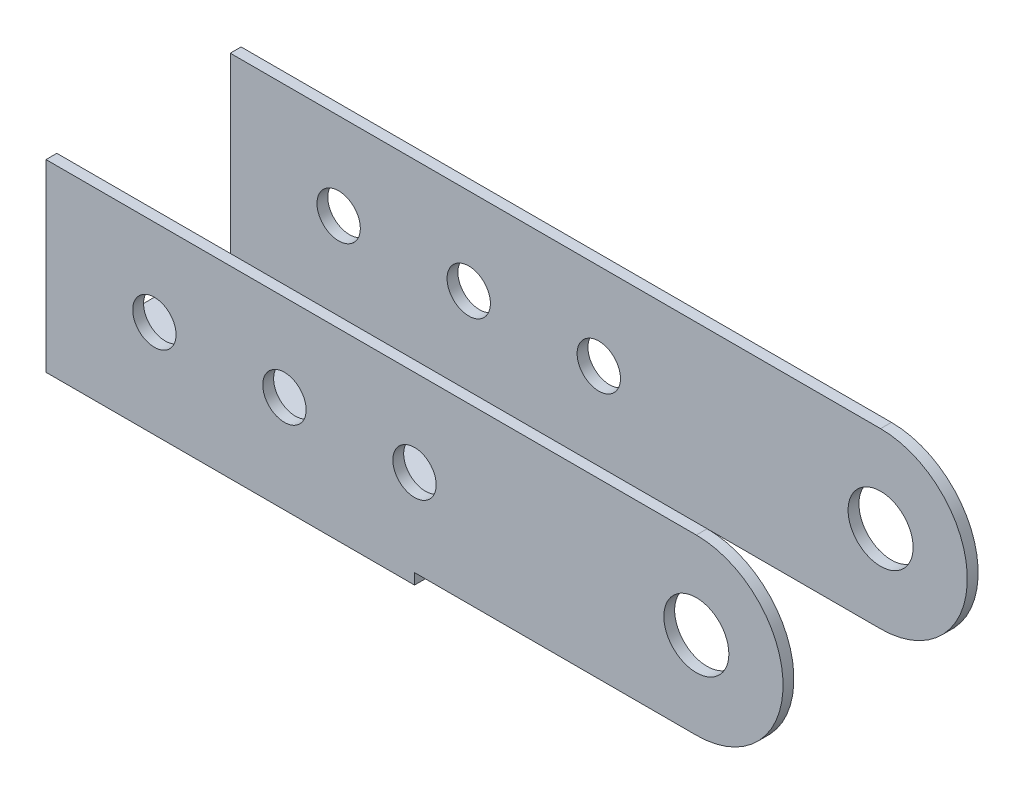
from build123d import *

# Parameters (mm, degrees)
SKETCH_2_R      = 1.5
SKETCH_2_R_2    = 1
EXTRUDE_1_DEPTH = 0.5
SKETCH_1_R      = 1.5
SKETCH_1_R_2    = 1
EXTRUDE_2_DEPTH = 0.5
SKETCH_3_W      = 17
SKETCH_3_H      = 9
EXTRUDE_3_DEPTH = 0.5


with BuildPart() as part:
    # 草图2 → 凸台-拉伸1 (new body)
    with BuildSketch(Plane.XY.offset(8)):
        with BuildLine():
            Line((15, 4), (-15, 4))
            Line((-15, 4), (-15, -4))
            Line((-15, -4), (15, -4))
            ThreePointArc((15, -4), (19, 0), (15, 4))
        make_face()
        with Locations((15, 0)):
            Circle(SKETCH_2_R, mode=Mode.SUBTRACT)
        with Locations((2, 0)):
            Circle(SKETCH_2_R_2, mode=Mode.SUBTRACT)
        with Locations((-4, 0)):
            Circle(SKETCH_2_R_2, mode=Mode.SUBTRACT)
        with Locations((-10, 0)):
            Circle(SKETCH_2_R_2, mode=Mode.SUBTRACT)
    extrude(amount=EXTRUDE_1_DEPTH)



with BuildPart() as body_2:
    # 草图1 → 凸台-拉伸2 (new body)
    with BuildSketch(Plane.XY):
        with BuildLine():
            Line((-15, 4), (15, 4))
            ThreePointArc((15, 4), (19, 0), (15, -4))
            Line((15, -4), (-15, -4))
            Line((-15, -4), (-15, 4))
        make_face()
        with Locations((15, 0)):
            Circle(SKETCH_1_R, mode=Mode.SUBTRACT)
        with Locations((-10, 0)):
            Circle(SKETCH_1_R_2, mode=Mode.SUBTRACT)
        with Locations((-4, 0)):
            Circle(SKETCH_1_R_2, mode=Mode.SUBTRACT)
        with Locations((2, 0)):
            Circle(SKETCH_1_R_2, mode=Mode.SUBTRACT)
    extrude(amount=-EXTRUDE_2_DEPTH)


with BuildPart() as part_1:
    add(part.part)

    add(body_2.part)  # 凸台-拉伸3 merges body 2
    # 草图3 → 凸台-拉伸3 (add)
    with BuildSketch(Plane(origin=(0, -4, 0), x_dir=(-1, 0, 0), z_dir=(0, -1, 0))):
        with Locations((6.5, -4)):
            Rectangle(SKETCH_3_W, SKETCH_3_H)
    extrude(amount=EXTRUDE_3_DEPTH)


solid = part_1.part
